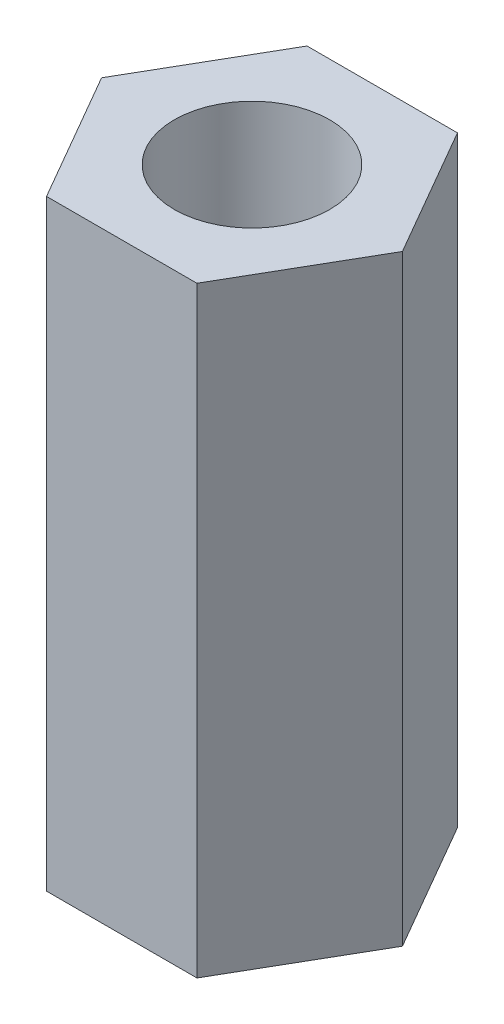
from build123d import *

# Parameters (mm, degrees)
BOSS_EXTRUDE1_DEPTH = 10
SKETCH2_R           = 1.291917854
CUT_EXTRUDE1_DEPTH  = 11.532687216


with BuildPart() as part:
    # Sketch1 → Boss-Extrude1 (new body)
    with BuildSketch(Plane(origin=(0, 0, 0), x_dir=(1, 0, 0), z_dir=(0, 1, 0))):
        Polygon((2.5, 0), (1.25, 2.165063509), (-1.25, 2.165063509), (-2.5, 0), (-1.25, -2.165063509), (1.25, -2.165063509), align=None)
    extrude(amount=BOSS_EXTRUDE1_DEPTH)

    # Sketch2 → Cut-Extrude1 (cut, through all)
    with BuildSketch(Plane(origin=(0, 10, 0), x_dir=(1, 0, 0), z_dir=(0, 1, 0))):
        with Locations(Location((0, 0, 0), (0, 0, 270))):
            Circle(SKETCH2_R)
    extrude(amount=-CUT_EXTRUDE1_DEPTH, mode=Mode.SUBTRACT)


solid = part.part
